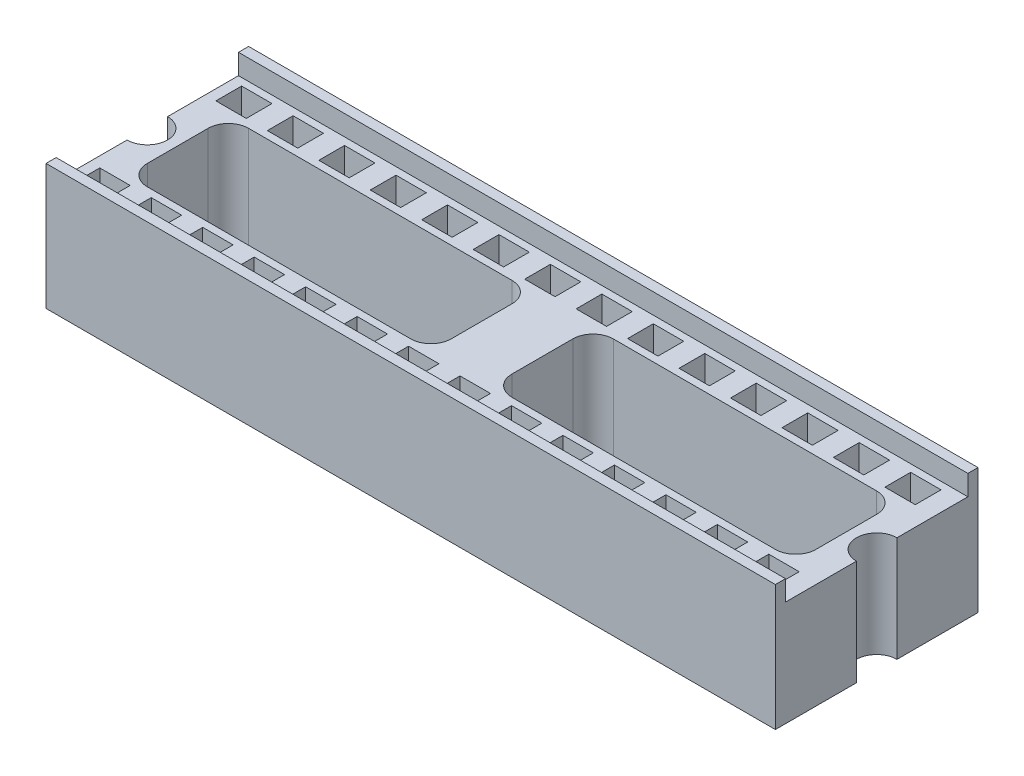
from build123d import *

# Parameters (mm, degrees)
BOSS_EXTRU_1_DEPTH      = 6.2
ESQUISSE4_W             = 9
ESQUISSE4_H             = 1.618443578
ENL_V_MAT_EXTRU_1_DEPTH = 40.6
ESQUISSE5_W             = 1.5
ESQUISSE5_H             = 1.27
ENL_V_MAT_EXTRU_2_DEPTH = 4.5


with BuildPart() as part:
    # Esquisse2 → Boss.-Extru.1 (new body)
    with BuildSketch(Plane(origin=(0, 0, 0), x_dir=(1, 0, 0), z_dir=(0, 1, 0))):
        with BuildLine():
            Line((-18, -5), (18, -5))
            Line((18, -5), (18, -1))
            ThreePointArc((18, -1), (17, 0), (18, 1))
            Line((18, 1), (18, 5))
            Line((18, 5), (-18, 5))
            Line((-18, 5), (-18, 1))
            ThreePointArc((-18, 1), (-17, 0), (-18, -1))
            Line((-18, -1), (-18, -5))
        make_face()
        with BuildLine():
            Line((1.5, -1.5), (1.5, 1.5))
            ThreePointArc((1.5, 1.5), (1.792893219, 2.207106781), (2.5, 2.5))
            Line((2.5, 2.5), (15.5, 2.5))
            ThreePointArc((15.5, 2.5), (16.207106781, 2.207106781), (16.5, 1.5))
            Line((16.5, 1.5), (16.5, -1.5))
            ThreePointArc((16.5, -1.5), (16.207106781, -2.207106781), (15.5, -2.5))
            Line((15.5, -2.5), (2.5, -2.5))
            ThreePointArc((2.5, -2.5), (1.792893219, -2.207106781), (1.5, -1.5))
        make_face(mode=Mode.SUBTRACT)
        with BuildLine():
            Line((-15.5, -2.5), (-2.5, -2.5))
            ThreePointArc((-2.5, -2.5), (-1.792893219, -2.207106781), (-1.5, -1.5))
            Line((-1.5, -1.5), (-1.5, 1.5))
            ThreePointArc((-1.5, 1.5), (-1.792893219, 2.207106781), (-2.5, 2.5))
            Line((-2.5, 2.5), (-15.5, 2.5))
            ThreePointArc((-15.5, 2.5), (-16.207106781, 2.207106781), (-16.5, 1.5))
            Line((-16.5, 1.5), (-16.5, -1.5))
            ThreePointArc((-16.5, -1.5), (-16.207106781, -2.207106781), (-15.5, -2.5))
        make_face(mode=Mode.SUBTRACT)
    extrude(amount=-BOSS_EXTRU_1_DEPTH)

    # Esquisse4 → Enlèv. mat.-Extru.1 (cut)
    with BuildSketch(Plane(origin=(18, 0, 0), x_dir=(0, 0, -1), z_dir=(1, 0, 0))):
        with Locations((0, -0.190778211)):
            Rectangle(ESQUISSE4_W, ESQUISSE4_H)
    extrude(amount=-ENL_V_MAT_EXTRU_1_DEPTH, mode=Mode.SUBTRACT)

    # Esquisse5 → Enlèv. mat.-Extru.2 (cut)
    with BuildSketch(Plane(origin=(0, -1, 0), x_dir=(1, 0, 0), z_dir=(0, 1, 0))):
        with Locations((-16.73, 3.5)):
            Rectangle(ESQUISSE5_W, ESQUISSE5_H)
        with Locations((-14.19, 3.5)):
            Rectangle(ESQUISSE5_W, ESQUISSE5_H)
        with Locations((-11.65, 3.5)):
            Rectangle(ESQUISSE5_W, ESQUISSE5_H)
        with Locations((-9.11, 3.5)):
            Rectangle(ESQUISSE5_W, ESQUISSE5_H)
        with Locations((-6.57, 3.5)):
            Rectangle(ESQUISSE5_W, ESQUISSE5_H)
        with Locations((-4.03, 3.5)):
            Rectangle(ESQUISSE5_W, ESQUISSE5_H)
        with Locations((-1.49, 3.5)):
            Rectangle(ESQUISSE5_W, ESQUISSE5_H)
        with Locations((1.05, 3.5)):
            Rectangle(ESQUISSE5_W, ESQUISSE5_H)
        with Locations((3.59, 3.5)):
            Rectangle(ESQUISSE5_W, ESQUISSE5_H)
        with Locations((6.13, 3.5)):
            Rectangle(ESQUISSE5_W, ESQUISSE5_H)
        with Locations((8.67, 3.5)):
            Rectangle(ESQUISSE5_W, ESQUISSE5_H)
        with Locations((11.21, 3.5)):
            Rectangle(ESQUISSE5_W, ESQUISSE5_H)
        with Locations((13.75, 3.5)):
            Rectangle(ESQUISSE5_W, ESQUISSE5_H)
        with Locations((16.29, 3.5)):
            Rectangle(ESQUISSE5_W, ESQUISSE5_H)
    enl_v_mat_extru_2 = extrude(amount=-ENL_V_MAT_EXTRU_2_DEPTH, mode=Mode.SUBTRACT)

    # Symétrie1: Enlèv. mat.-Extru.2 across plane
    add(enl_v_mat_extru_2.mirror(Plane.XY), mode=Mode.SUBTRACT)


solid = part.part
